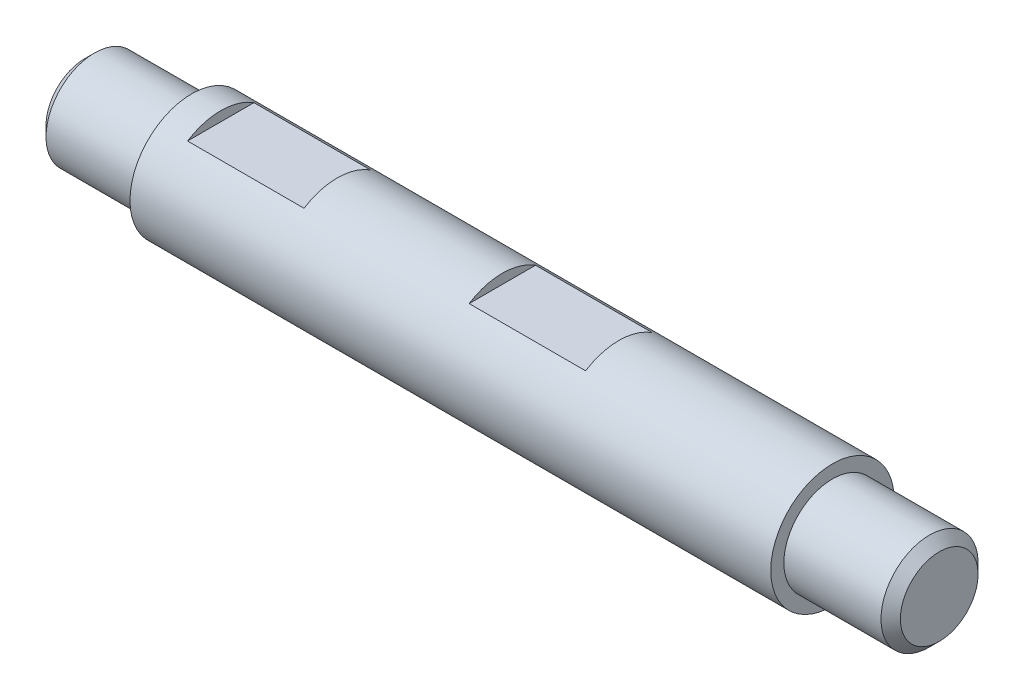
from build123d import *

# Parameters (mm, degrees)
CHAMFER1_SIZE           = 1
CUT_EXTRUDE1_DEPTH      = 45.907070713
CUT_EXTRUDE1_DEPTH_BACK = 45.907070713
SKETCH3_W               = 11.997849067
SKETCH3_H               = 0.999274346
SKETCH3_W_2             = 11.999787666
CUT_EXTRUDE2_DEPTH      = 3


with BuildPart() as part:
    # Sketch2 → Revolve1 (revolve)
    with BuildSketch(Plane.XY, mode=Mode.PRIVATE) as revolve1_sk:
        Polygon((33, 6.35), (-33, 6.35), (-33, 5), (-44, 5), (-44, 0), (44, 0), (44, 5), (33, 5), align=None)
    revolve(revolve1_sk.sketch.rotate(Axis((-44, 0, 0), (1, 0, 0)), 90), axis=Axis((-44, 0, 0), (1, 0, 0)))

    # Chamfer1
    chamfer1_edges = [part.edges().sort_by_distance(p)[0] for p in [
        (44, 0, -5),
        (-44, 0, -5),
    ]]
    chamfer(chamfer1_edges, length=CHAMFER1_SIZE)

    # Sketch3 → Cut-Extrude1 (cut, two sides: drawn at the far end of the back side and taken through both)
    with BuildSketch(Plane.XY.offset(-CUT_EXTRUDE1_DEPTH_BACK)):
        with Locations((5.001075466, 5.850362827)):
            Rectangle(SKETCH3_W, SKETCH3_H)
        with Locations((-24.000665712, 5.850362827)):
            Rectangle(SKETCH3_W_2, SKETCH3_H)
    extrude(amount=CUT_EXTRUDE1_DEPTH + CUT_EXTRUDE1_DEPTH_BACK, mode=Mode.SUBTRACT)

    # Sketch6 → Cut-Extrude2 (cut)
    with BuildSketch(Plane(origin=(0, -6.35, 0), x_dir=(1, 0, 0), z_dir=(0, 1, 0))):
        with BuildLine():
            Line((19.5, 2.5), (-7.500665679, 2.5))
            ThreePointArc((-7.500665679, 2.5), (-9.268432632, 1.767766953), (-10.000665679, 0))
            Line((-10.000665679, 0), (-10.000665679, -0.006446088))
            ThreePointArc((-10.000665679, -0.006446088), (-9.271361564, -1.767141973), (-7.510665679, -2.496446088))
            Line((-7.510665679, -2.496446088), (19.51, -2.496446088))
            ThreePointArc((19.51, -2.496446088), (21.270695885, -1.767141973), (22, -0.006446088))
            Line((22, -0.006446088), (22, 0))
            ThreePointArc((22, 0), (21.267766953, 1.767766953), (19.5, 2.5))
        make_face()
    extrude(amount=CUT_EXTRUDE2_DEPTH, mode=Mode.SUBTRACT)


solid = part.part
